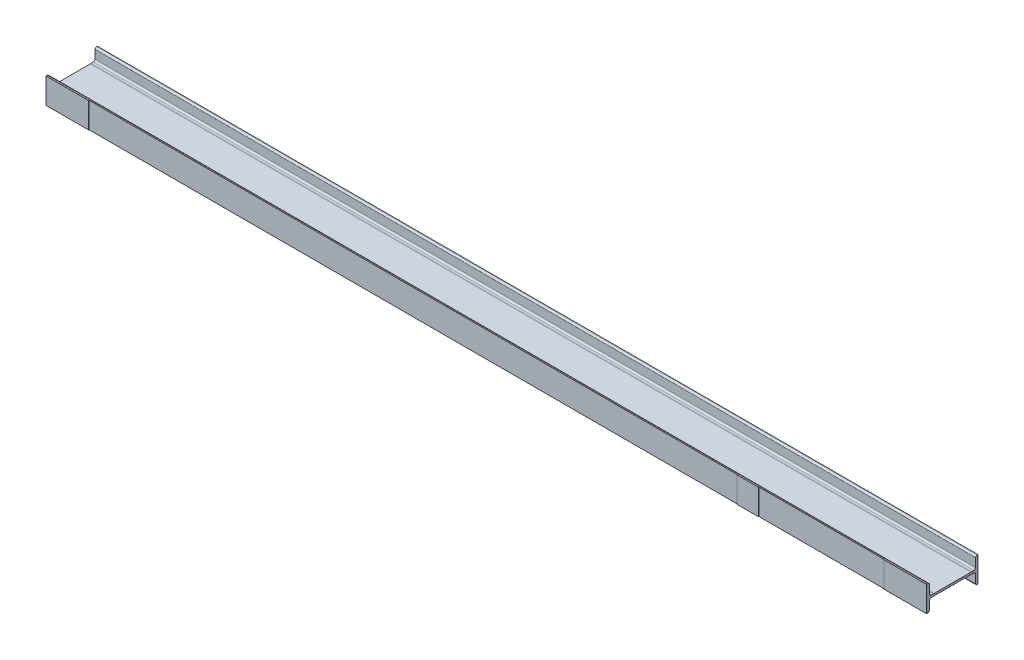
from build123d import *

# Parameters (mm, degrees)
VIGA_SB_120_X_12_2_DEPTH   = 2070
CORTAR_EXTRUIR1_DEPTH      = 2072.086671291
CORTAR_EXTRUIR1_DEPTH_BACK = 2072.086671291
CROQUIS4_W                 = 50.341677604
CROQUIS4_H                 = 60
SALIENTE_EXTRUIR1_DEPTH    = 1
CROQUIS6_W                 = 100
CROQUIS6_H                 = 60
SALIENTE_EXTRUIR2_DEPTH    = 1
SALIENTE_EXTRUIR2_2_DEPTH  = 1


with BuildPart() as part:
    # Sketch12 → Viga sb 120 X 12(2) (new body)
    with BuildSketch(Plane.YZ):
        with BuildLine():
            Line((-30, -60), (-30, -58.080070835))
            ThreePointArc((-30, -58.080070835), (-29.052095223, -55.494589303), (-26.657642624, -54.134502919))
            Line((-26.657642624, -54.134502919), (-9.184714752, -51.222135832))
            ThreePointArc((-9.184714752, -51.222135832), (-4.395809555, -48.501963064), (-2.5, -43.331))
            Line((-2.5, -43.331), (-2.5, 43.331))
            ThreePointArc((-2.5, 43.331), (-4.395809555, 48.501963064), (-9.184714752, 51.222135832))
            Line((-9.184714752, 51.222135832), (-26.657642624, 54.134502919))
            ThreePointArc((-26.657642624, 54.134502919), (-29.052095223, 55.494589303), (-30, 58.080070835))
            Line((-30, 58.080070835), (-30, 60))
            Line((-30, 60), (30, 60))
            Line((30, 60), (30, 58.080070835))
            ThreePointArc((30, 58.080070835), (29.052095223, 55.494589303), (26.657642624, 54.134502919))
            Line((26.657642624, 54.134502919), (9.184714752, 51.222135832))
            ThreePointArc((9.184714752, 51.222135832), (4.395809555, 48.501963064), (2.5, 43.331))
            Line((2.5, 43.331), (2.5, -43.331))
            ThreePointArc((2.5, -43.331), (4.395809555, -48.501963064), (9.184714752, -51.222135832))
            Line((9.184714752, -51.222135832), (26.657642624, -54.134502919))
            ThreePointArc((26.657642624, -54.134502919), (29.052095223, -55.494589303), (30, -58.080070835))
            Line((30, -58.080070835), (30, -60))
            Line((30, -60), (-30, -60))
        make_face()
    extrude(amount=VIGA_SB_120_X_12_2_DEPTH)

    # Croquis3 → Cortar-Extruir1 (cut, two sides: drawn at the far end of the back side and taken through both)
    with BuildSketch(Plane.ZY.offset(-CORTAR_EXTRUIR1_DEPTH_BACK)):
        with BuildLine():
            Line((54.134502919, 26.657642624), (44.900203823, 26.657642624))
            Line((44.900203823, 26.657642624), (44.900203823, 2.655409548))
            Line((44.900203823, 2.655409548), (50.134502919, 2.655409548))
            ThreePointArc((50.134502919, 2.655409548), (52.962930044, 3.826982423), (54.134502919, 6.655409548))
            Line((54.134502919, 6.655409548), (54.134502919, 26.657642624))
        make_face()
        with BuildLine():
            Line((54.134502919, -26.657642624), (43.331, -26.657642624))
            Line((43.331, -26.657642624), (43.331, -2.5))
            Line((43.331, -2.5), (50.134502919, -2.5))
            ThreePointArc((50.134502919, -2.5), (52.962930044, -3.671572875), (54.134502919, -6.5))
            Line((54.134502919, -6.5), (54.134502919, -26.657642624))
        make_face()
        with BuildLine():
            Line((-43.331, -26.657642624), (-43.331, -2.5))
            Line((-43.331, -2.5), (-50.134502919, -2.5))
            ThreePointArc((-50.134502919, -2.5), (-52.962930044, -3.671572875), (-54.134502919, -6.5))
            Line((-54.134502919, -6.5), (-54.134502919, -26.657642624))
            Line((-54.134502919, -26.657642624), (-43.331, -26.657642624))
        make_face()
        with BuildLine():
            Line((-44.900203823, 26.657642624), (-44.900203823, 2.655409548))
            Line((-44.900203823, 2.655409548), (-50.134502919, 2.655409548))
            ThreePointArc((-50.134502919, 2.655409548), (-52.962930044, 3.826982423), (-54.134502919, 6.655409548))
            Line((-54.134502919, 6.655409548), (-54.134502919, 26.657642624))
            Line((-54.134502919, 26.657642624), (-44.900203823, 26.657642624))
        make_face()
    extrude(amount=CORTAR_EXTRUIR1_DEPTH + CORTAR_EXTRUIR1_DEPTH_BACK, mode=Mode.SUBTRACT)


with BuildPart() as body_2:
    # Croquis4 → Saliente-Extruir1 (new body)
    with BuildSketch(Plane.XY.offset(60)):
        with Locations((1650, 0)):
            Rectangle(CROQUIS4_W, CROQUIS4_H)
    extrude(amount=SALIENTE_EXTRUIR1_DEPTH)


with BuildPart() as body_3:
    # Croquis6 → Saliente-Extruir2 (new body)
    with BuildSketch(Plane.XY.offset(60)):
        with Locations((2020, 0)):
            Rectangle(CROQUIS6_W, CROQUIS6_H)
    extrude(amount=SALIENTE_EXTRUIR2_DEPTH)


with BuildPart() as body_4:
    # Croquis6 → Saliente-Extruir2 2 (new body)
    with BuildSketch(Plane.XY.offset(60)):
        with Locations((50, 0)):
            Rectangle(CROQUIS6_W, CROQUIS6_H)
    extrude(amount=SALIENTE_EXTRUIR2_2_DEPTH)


solid = Compound([part.part, body_2.part, body_3.part, body_4.part])
